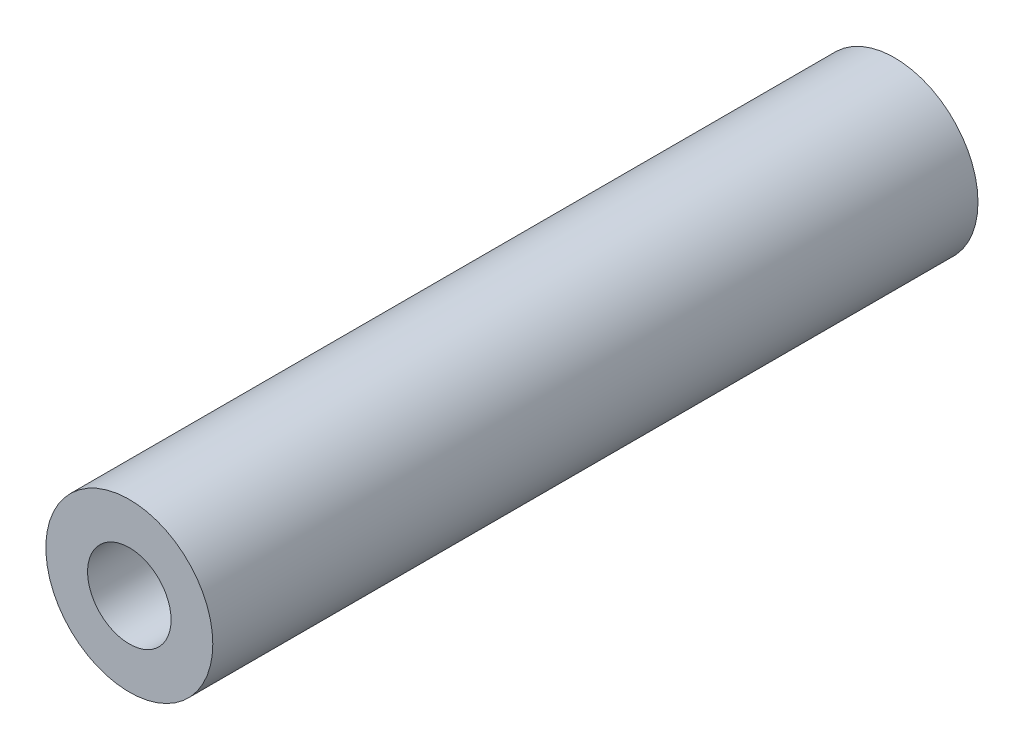
from build123d import *

# Parameters (mm, degrees)
SKETCH1_R           = 6
SKETCH1_R_2         = 3
BOSS_EXTRUDE1_DEPTH = 55


with BuildPart() as part:
    # Sketch1 → Boss-Extrude1 (new body)
    with BuildSketch(Plane.XY):
        Circle(SKETCH1_R)
        Circle(SKETCH1_R_2, mode=Mode.SUBTRACT)
    extrude(amount=BOSS_EXTRUDE1_DEPTH)


solid = part.part
